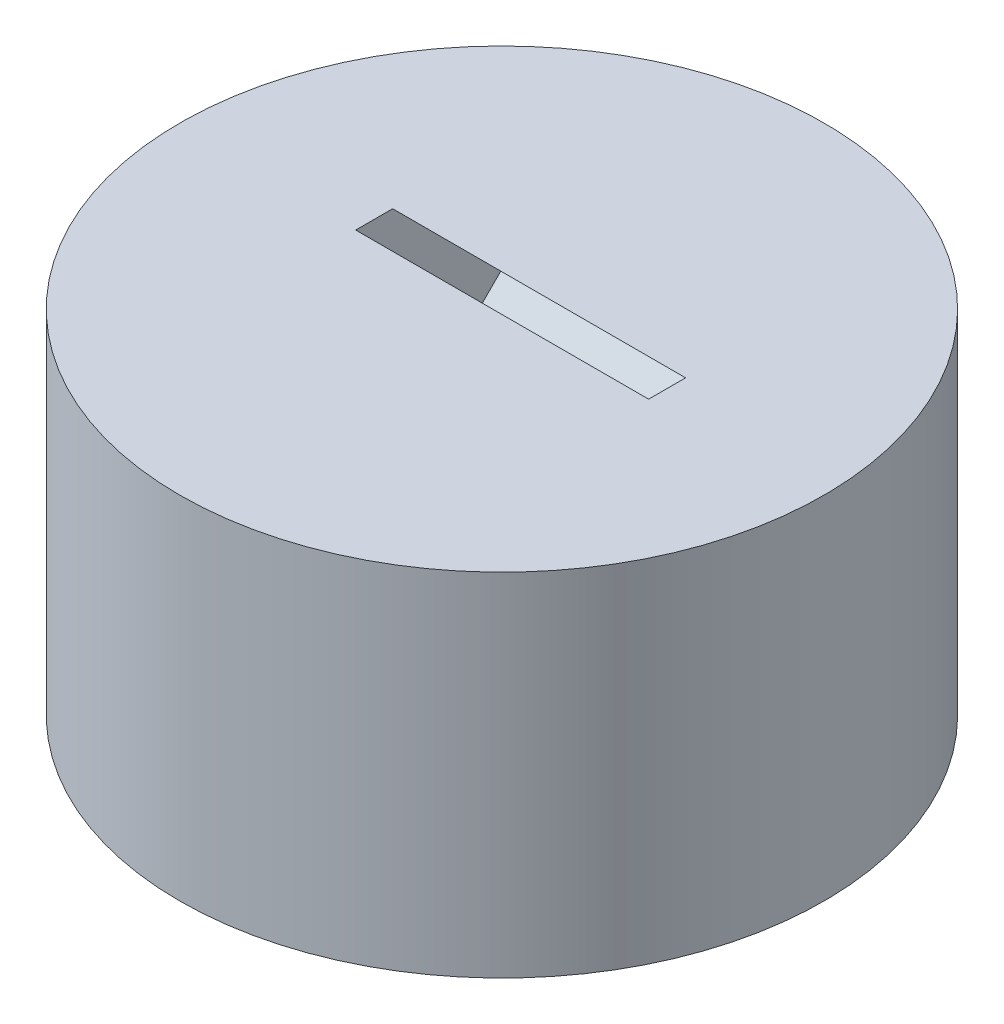
from build123d import *

# Parameters (mm, degrees)
SKETCH1_R               = 5.5
BOSS_EXTRUDE1_DEPTH     = 6
CUT_EXTRUDE1_DEPTH      = 3
CUT_EXTRUDE1_DEPTH_BACK = 3
SKETCH3_W               = 5
SKETCH3_H               = 0.446225232


with BuildPart() as part:
    # Sketch1 → Boss-Extrude1 (new body)
    with BuildSketch(Plane(origin=(0, 0, 0), x_dir=(1, 0, 0), z_dir=(0, 1, 0))):
        Circle(SKETCH1_R)
    extrude(amount=BOSS_EXTRUDE1_DEPTH)

    # Sketch3 → Cut-Extrude1 (cut, two sides: drawn at the far end of the back side and taken through both)
    with BuildSketch(Plane(origin=(0, 3, 3), x_dir=(1, 0, 0), z_dir=(0, 0.7071067811865464, 0.7071067811865488)).offset(-CUT_EXTRUDE1_DEPTH_BACK)):
        with Locations((0.083557951, 4.409395003)):
            Rectangle(SKETCH3_W, SKETCH3_H)
    extrude(amount=CUT_EXTRUDE1_DEPTH + CUT_EXTRUDE1_DEPTH_BACK, mode=Mode.SUBTRACT)


solid = part.part
